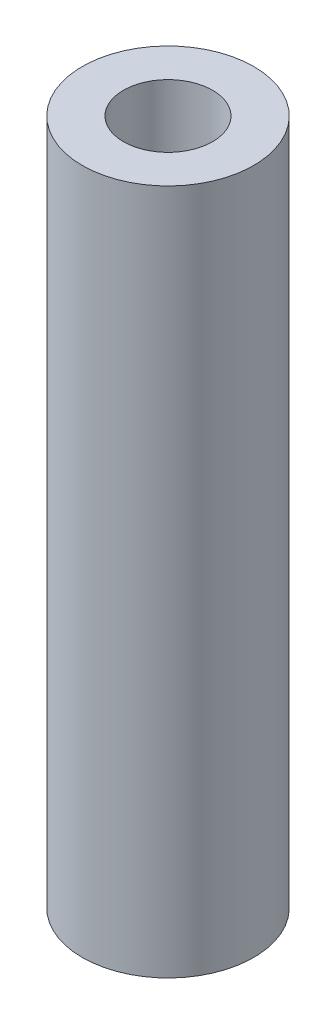
from build123d import *

# Parameters (mm, degrees)
SKETCH1_R           = 6.35
SKETCH1_R_2         = 3.302
BOSS_EXTRUDE1_DEPTH = 25.4


with BuildPart() as part:
    # Sketch1 → Boss-Extrude1 (new, symmetric)
    with BuildSketch(Plane(origin=(0, 0, 0), x_dir=(1, 0, 0), z_dir=(0, 1, 0))):
        with Locations(Location((0, 0, 0), (0, 0, 270))):
            Circle(SKETCH1_R)
        with Locations(Location((0, 0, 0), (0, 0, 270))):
            Circle(SKETCH1_R_2, mode=Mode.SUBTRACT)
    extrude(amount=BOSS_EXTRUDE1_DEPTH, both=True)


solid = part.part
